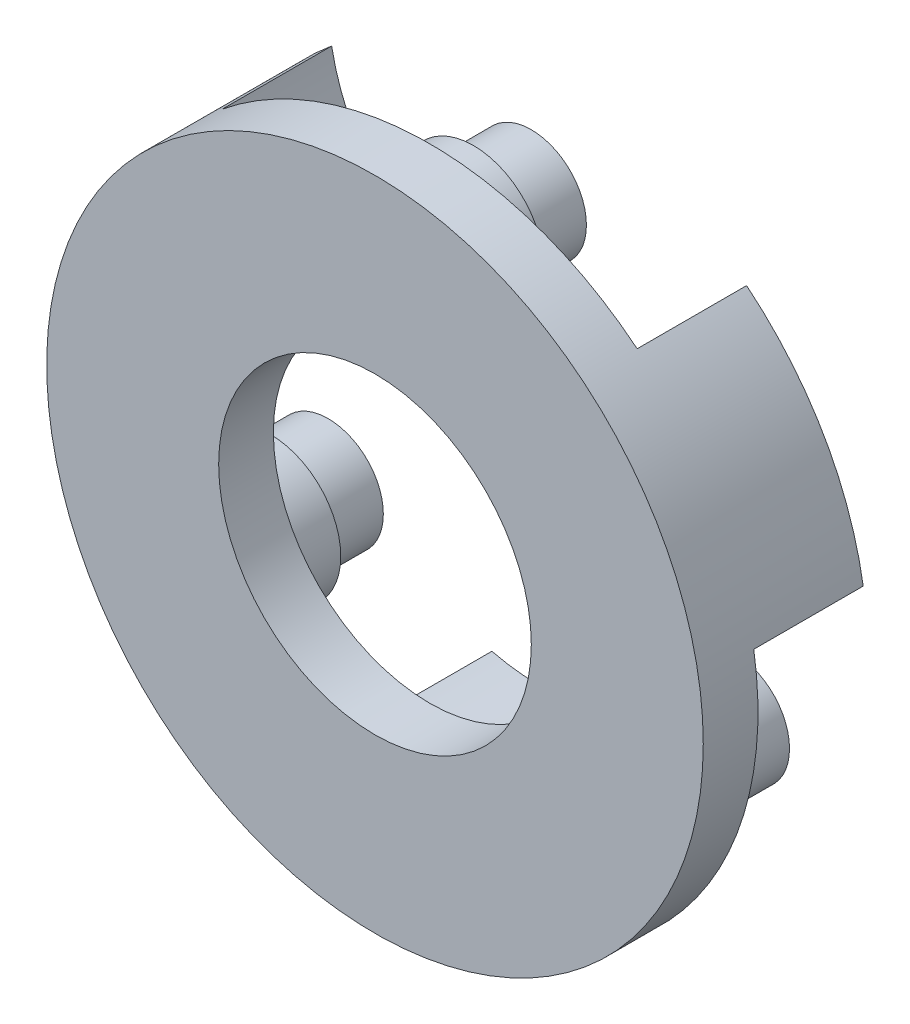
from build123d import *
from build123d.topology import SkipClean

# Parameters (mm, degrees)
SKETCH1_R           = 21
BOSS_EXTRUDE1_DEPTH = 3.5
SKETCH4_R           = 10
CUT_EXTRUDE1_DEPTH  = 8.2
SKETCH11_R          = 1.5
CUT_EXTRUDE2_DEPTH  = 10
BOSS_EXTRUDE2_START = 7
BOSS_EXTRUDE2_DEPTH = 7
SKETCH14_R          = 1.5
CUT_EXTRUDE3_DEPTH  = 5
SKETCH16_R          = 3.525
BOSS_EXTRUDE3_DEPTH = 10
SKETCH17_R          = 4.5
BOSS_EXTRUDE4_DEPTH = 2.8


with BuildPart() as part:
    # Sketch1 → Boss-Extrude1 (new body)
    with BuildSketch(Plane.XY):
        Circle(SKETCH1_R)
    extrude(amount=BOSS_EXTRUDE1_DEPTH)

    # Sketch4 → Cut-Extrude1 (cut)
    with BuildSketch(Plane(origin=(0, 0, 0), x_dir=(-1, 0, 0), z_dir=(0, 0, -1))):
        Circle(SKETCH4_R)
    extrude(amount=-CUT_EXTRUDE1_DEPTH, mode=Mode.SUBTRACT)

    # Sketch11 → Cut-Extrude2 (cut)
    with BuildSketch(Plane(origin=(0, 0, 0), x_dir=(-1, 0, 0), z_dir=(0, 0, -1))):
        with Locations((0, 15)):
            Circle(SKETCH11_R)
        with Locations((12.990381057, -7.5)):
            Circle(SKETCH11_R)
        with Locations((-12.990381057, -7.5)):
            Circle(SKETCH11_R)
    extrude(amount=-CUT_EXTRUDE2_DEPTH, mode=Mode.SUBTRACT)

    # Sketch3 → Boss-Extrude2 (add)
    with SkipClean():  # the faces are left unmerged after this step: merging them gives an invalid solid
        with BuildSketch(Plane(origin=(0, 0, 0), x_dir=(-1, 0, 0), z_dir=(0, 0, -1)).offset(BOSS_EXTRUDE2_START)):
            with BuildLine():
                ThreePointArc((-3.021915591, -12.129221993), (-4.618435811, -16.247865366), (-7.4589705, -19.630684121))
                ThreePointArc((-7.4589705, -19.630684121), (0, -21), (7.4589705, -19.630684121))
                ThreePointArc((7.4589705, -19.630684121), (4.618435811, -16.247865366), (3.021915591, -12.129221993))
                ThreePointArc((3.021915591, -12.129221993), (0, -12.5), (-3.021915591, -12.129221993))
            make_face()
            with BuildLine():
                ThreePointArc((-20.730156393, 3.355684121), (-16.38028207, 4.124249945), (-12.01517217, 3.447555327))
                ThreePointArc((-12.01517217, 3.447555327), (-10.825317547, 6.25), (-8.993256579, 8.681666667))
                ThreePointArc((-8.993256579, 8.681666667), (-11.761846259, 12.123615422), (-13.271185893, 16.275))
                ThreePointArc((-13.271185893, 16.275), (-18.186533479, 10.5), (-20.730156393, 3.355684121))
            make_face()
            with BuildLine():
                ThreePointArc((8.993256579, 8.681666667), (10.825317547, 6.25), (12.01517217, 3.447555327))
                ThreePointArc((12.01517217, 3.447555327), (16.38028207, 4.124249945), (20.730156393, 3.355684121))
                ThreePointArc((20.730156393, 3.355684121), (18.186533479, 10.5), (13.271185893, 16.275))
                ThreePointArc((13.271185893, 16.275), (11.761846259, 12.123615422), (8.993256579, 8.681666667))
            make_face()
        extrude(amount=-BOSS_EXTRUDE2_DEPTH)

    # Sketch14 → Cut-Extrude3 (cut)
    with SkipClean():  # the faces are left unmerged after this step: merging them gives an invalid solid
        with BuildSketch(Plane(origin=(0, 0, -7), x_dir=(-1, 0, 0), z_dir=(0, 0, -1))):
            with Locations((13.856406461, 8)):
                Circle(SKETCH14_R)
            with Locations((0, -16)):
                Circle(SKETCH14_R)
            with Locations((-13.856406461, 8)):
                Circle(SKETCH14_R)
        extrude(amount=-CUT_EXTRUDE3_DEPTH, mode=Mode.SUBTRACT)

    # Sketch16 → Boss-Extrude3 (add)
    with SkipClean():  # the faces are left unmerged after this step: merging them gives an invalid solid
        with BuildSketch(Plane.XY.offset(3.5)):
            with Locations((0, 15)):
                Circle(SKETCH16_R)
            with Locations((12.990381057, -7.5)):
                Circle(SKETCH16_R)
            with Locations((-12.990381057, -7.5)):
                Circle(SKETCH16_R)
        extrude(amount=-BOSS_EXTRUDE3_DEPTH)

    # Sketch17 → Boss-Extrude4 (add)
    with SkipClean():  # the faces are left unmerged after this step: merging them gives an invalid solid
        with BuildSketch(Plane(origin=(0, 0, 0), x_dir=(-1, 0, 0), z_dir=(0, 0, -1))):
            with Locations(Location((0, 15, 0), (0, 0, 180))):
                Circle(SKETCH17_R)
            with Locations(Location((12.990381057, -7.5, 0), (0, 0, 180))):
                Circle(SKETCH17_R)
            with Locations(Location((-12.990381057, -7.5, 0), (0, 0, 180))):
                Circle(SKETCH17_R)
        extrude(amount=BOSS_EXTRUDE4_DEPTH)


solid = part.part
